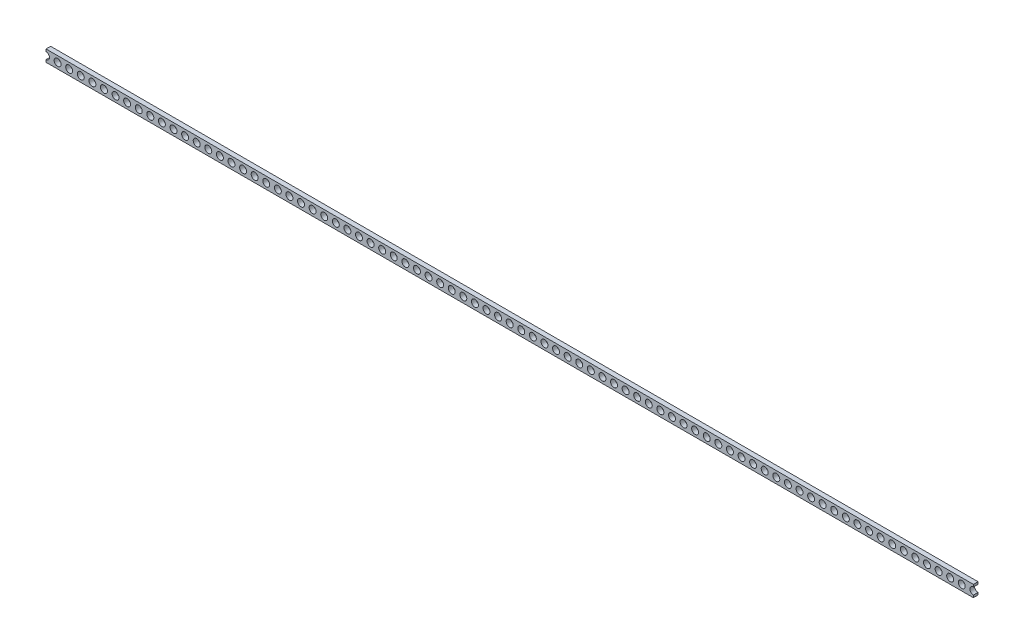
from build123d import *

# Parameters (mm, degrees)
SKETCH_1_W             = 400
SKETCH_1_H             = 5
EXTRUDE_1_DEPTH        = 2
SKETCH_2_R             = 1.5
CUT_EXTRUDE_1_DEPTH    = 401.036248358
PATTERN_LINEAR_1_COUNT = 41
PATTERN_LINEAR_1_PITCH = 5
PATTERN_LINEAR_2_COUNT = 41
PATTERN_LINEAR_2_PITCH = 5


with BuildPart() as part:
    # 草图1 → 凸台-拉伸1 (new body)
    with BuildSketch(Plane.XY):
        with Locations((200, -2.5)):
            Rectangle(SKETCH_1_W, SKETCH_1_H)
    extrude(amount=EXTRUDE_1_DEPTH)

    # 草图2 → 切除-拉伸1 (cut, through all)
    with BuildSketch(Plane.XY.offset(2)):
        with Locations((200, -2.5)):
            Circle(SKETCH_2_R)
    cut_extrude_1 = extrude(amount=-CUT_EXTRUDE_1_DEPTH, mode=Mode.SUBTRACT)

    # 阵列(线性)1: 切除-拉伸1 ×41
    with Locations(*[(i * PATTERN_LINEAR_1_PITCH, 0, 0) for i in range(1, PATTERN_LINEAR_1_COUNT)]):
        add(cut_extrude_1, mode=Mode.SUBTRACT)

    # 阵列(线性)2: 切除-拉伸1 ×41
    with Locations(*[(-i * PATTERN_LINEAR_2_PITCH, 0, 0) for i in range(1, PATTERN_LINEAR_2_COUNT)]):
        add(cut_extrude_1, mode=Mode.SUBTRACT)


solid = part.part
